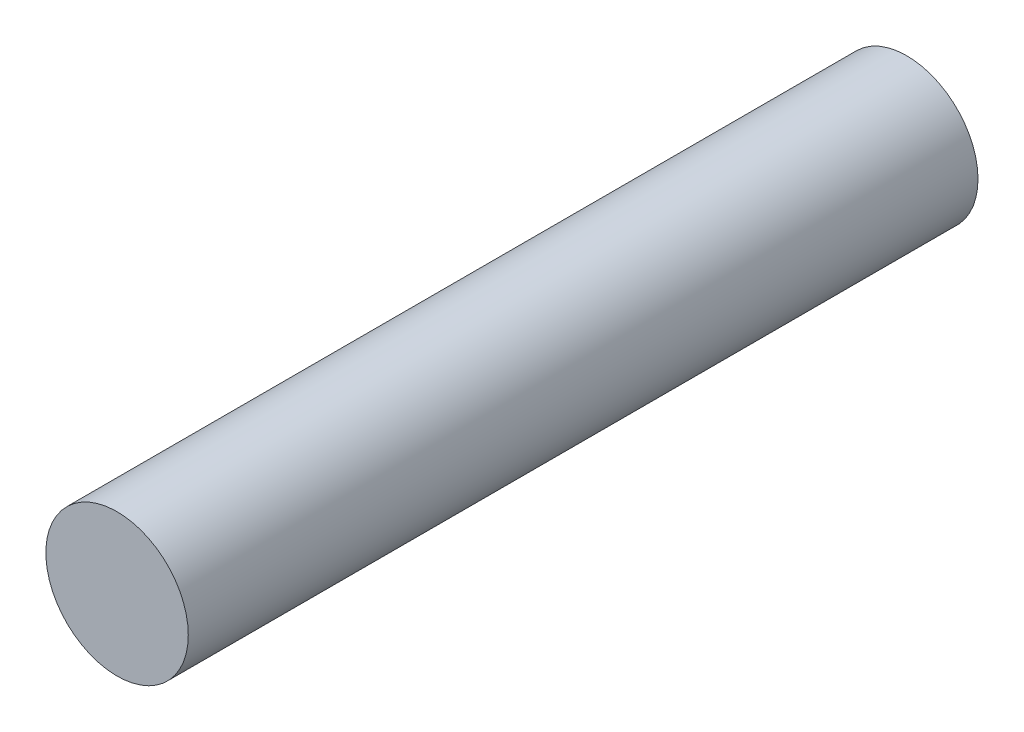
from build123d import *

# Parameters (mm, degrees)
SKETCH1_R           = 2.7051
BOSS_EXTRUDE1_DEPTH = 30


with BuildPart() as part:
    # Sketch1 → Boss-Extrude1 (new body)
    with BuildSketch(Plane.XY):
        Circle(SKETCH1_R)
    extrude(amount=BOSS_EXTRUDE1_DEPTH)


solid = part.part
